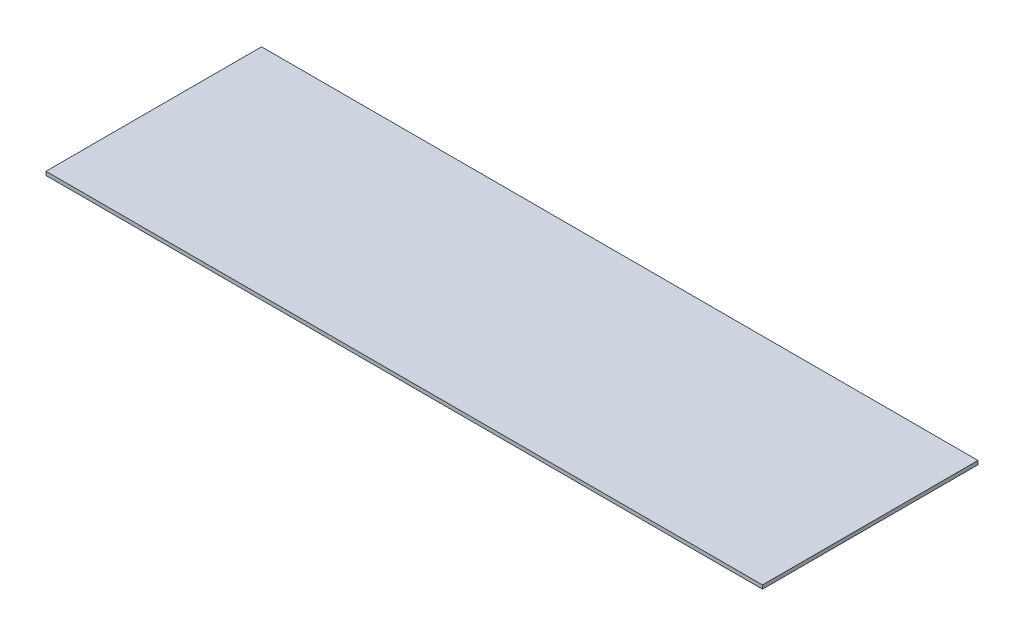
from build123d import *

# Parameters (mm, degrees)
SKETCH1_W           = 1219.2
SKETCH1_H           = 366.776
BOSS_EXTRUDE1_DEPTH = 6.35


with BuildPart() as part:
    # Sketch1 → Boss-Extrude1 (new body)
    with BuildSketch(Plane(origin=(0, 0, 0), x_dir=(1, 0, 0), z_dir=(0, 1, 0))):
        with Locations((609.6, 183.388)):
            Rectangle(SKETCH1_W, SKETCH1_H)
    extrude(amount=BOSS_EXTRUDE1_DEPTH)


solid = part.part
